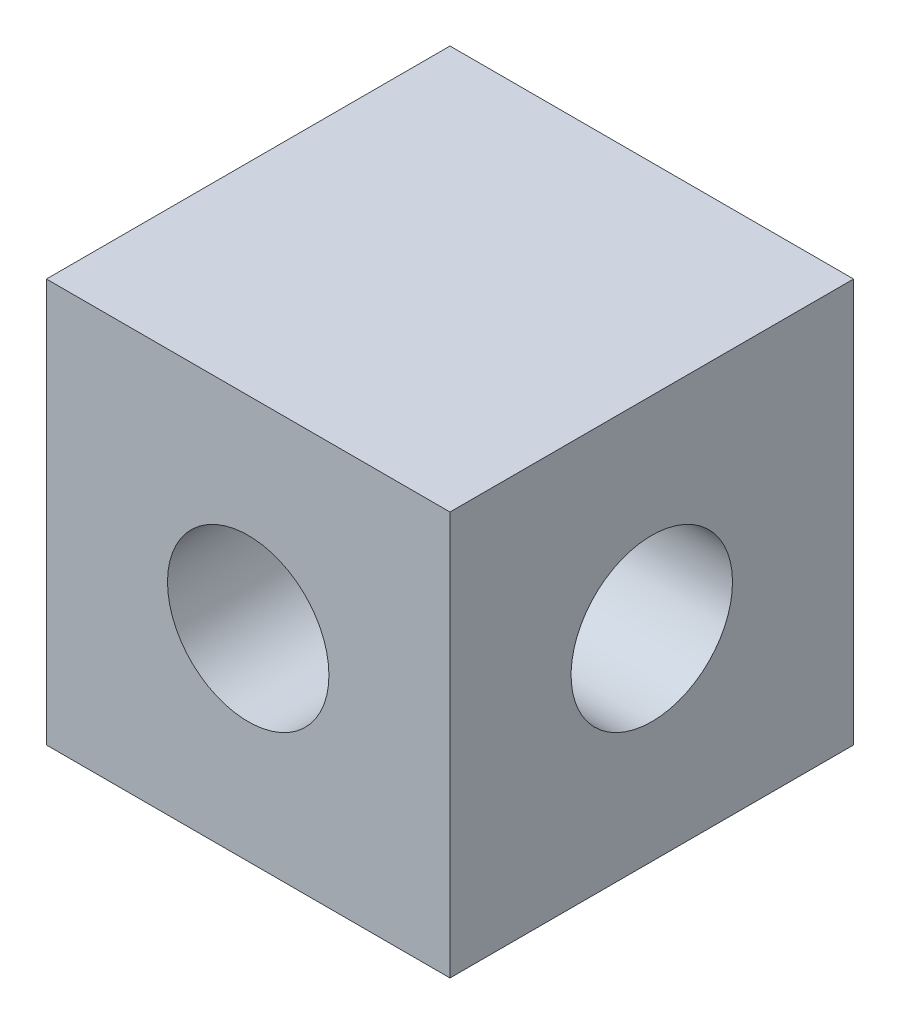
from build123d import *

# Parameters (mm, degrees)
SKETCH_1_W          = 10
SKETCH_1_H          = 10
SKETCH_1_R          = 2
EXTRUDE_1_DEPTH     = 10
SKETCH_2_R          = 2
CUT_EXTRUDE_1_DEPTH = 16


with BuildPart() as part:
    # 草图1 → 凸台-拉伸1 (new body)
    with BuildSketch(Plane(origin=(0, 0, 0), x_dir=(0, 0, -1), z_dir=(1, 0, 0))):
        Rectangle(SKETCH_1_W, SKETCH_1_H)
        Circle(SKETCH_1_R, mode=Mode.SUBTRACT)
    extrude(amount=EXTRUDE_1_DEPTH)

    # 草图2 → 切除-拉伸1 (cut, through all)
    with BuildSketch(Plane(origin=(0, 0, -5), x_dir=(-1, 0, 0), z_dir=(0, 0, -1))):
        with Locations((-5, 0)):
            Circle(SKETCH_2_R)
    extrude(amount=-CUT_EXTRUDE_1_DEPTH, mode=Mode.SUBTRACT)


solid = part.part
